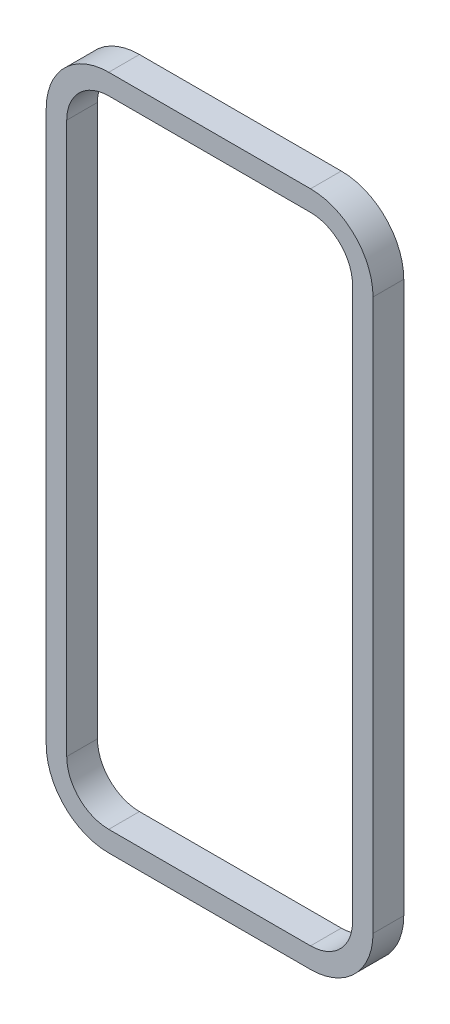
from build123d import *

# Parameters (mm, degrees)
BOSS_EXTRUDE1_DEPTH = 3


with BuildPart() as part:
    # Sketch1 → Boss-Extrude1 (new body)
    with BuildSketch(Plane(origin=(0, 0, 0), x_dir=(0, 1, 0), z_dir=(0, 0, 1))):
        with BuildLine():
            Line((-26.9, 15.95), (26.9, 15.95))
            ThreePointArc((26.9, 15.95), (31.213351365, 14.163351365), (33, 9.85))
            Line((33, 9.85), (33, -9.85))
            ThreePointArc((33, -9.85), (31.213351365, -14.163351365), (26.9, -15.95))
            Line((26.9, -15.95), (-26.9, -15.95))
            ThreePointArc((-26.9, -15.95), (-31.213351365, -14.163351365), (-33, -9.85))
            Line((-33, -9.85), (-33, 9.85))
            ThreePointArc((-33, 9.85), (-31.213351365, 14.163351365), (-26.9, 15.95))
        make_face()
        with BuildLine():
            Line((-26.9, 13.95), (26.9, 13.95))
            ThreePointArc((26.9, 13.95), (29.799137803, 12.749137803), (31, 9.85))
            Line((31, 9.85), (31, -9.85))
            ThreePointArc((31, -9.85), (29.799137803, -12.749137803), (26.9, -13.95))
            Line((26.9, -13.95), (-26.9, -13.95))
            ThreePointArc((-26.9, -13.95), (-29.799137803, -12.749137803), (-31, -9.85))
            Line((-31, -9.85), (-31, 9.85))
            ThreePointArc((-31, 9.85), (-29.799137803, 12.749137803), (-26.9, 13.95))
        make_face(mode=Mode.SUBTRACT)
    extrude(amount=BOSS_EXTRUDE1_DEPTH)


solid = part.part
